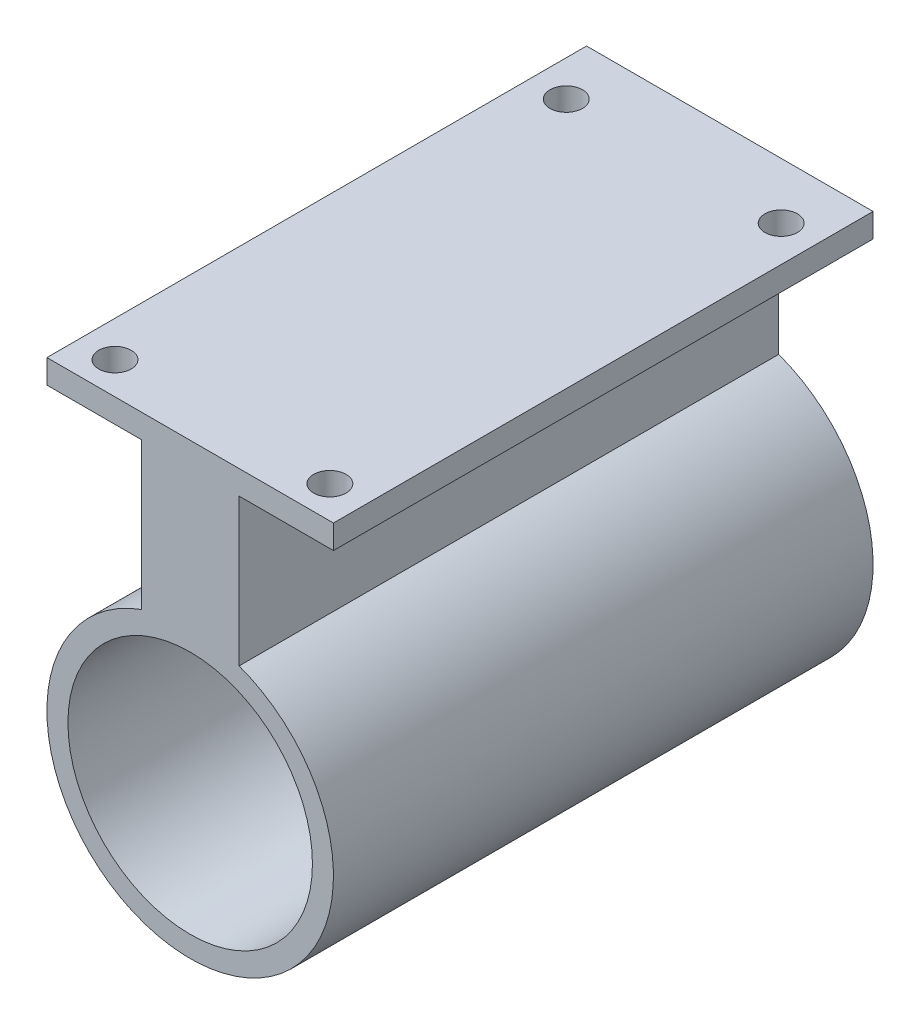
from build123d import *

# Parameters (mm, degrees)
CROQUIS1_R              = 12.5
SALIENTE_EXTRUIR1_DEPTH = 54
SALIENTE_EXTRUIR2_START = 2.5
CROQUIS2_R              = 15
SALIENTE_EXTRUIR2_DEPTH = 2.5
CROQUIS3_R              = 3.75
CORTAR_EXTRUIR2_DEPTH   = 2.5
CROQUIS5_R              = 1.5
CORTAR_EXTRUIR3_DEPTH   = 2.5
CROQUIS9_R              = 1.5
CORTAR_EXTRUIR5_DEPTH   = 2.5
SALIENTE_EXTRUIR3_START = 2.5
SALIENTE_EXTRUIR3_DEPTH = 2.5
CROQUIS11_R             = 12.8
CORTAR_EXTRUIR6_DEPTH   = 54
CROQUIS12_R             = 1.7
CORTAR_EXTRUIR7_DEPTH   = 2.5
CROQUIS16_R             = 1.7
CORTAR_EXTRUIR8_DEPTH   = 2.5
CROQUIS17_R             = 1.7
CORTAR_EXTRUIR9_DEPTH   = 2.5


with BuildPart() as part:
    # Croquis1 → Saliente-Extruir1 (new body)
    with BuildSketch(Plane.XY):
        with BuildLine():
            Line((-5.119897429, -1.25), (-15, -1.25))
            Line((-15, -1.25), (-15, 1.25))
            Line((-15, 1.25), (15, 1.25))
            Line((15, 1.25), (15, -1.25))
            Line((15, -1.25), (5.119897429, -1.25))
            Line((5.119897429, -1.25), (5.119897429, -13.25))
            Line((5.119897429, -13.25), (5.119897429, -16.650828027))
            ThreePointArc((5.119897429, -16.650828027), (0, -45.75), (-5.119897429, -16.650828027))
            Line((-5.119897429, -16.650828027), (-5.119897429, -13.25))
            Line((-5.119897429, -13.25), (-5.119897429, -1.25))
        make_face()
        with Locations((0, -30.75)):
            Circle(CROQUIS1_R, mode=Mode.SUBTRACT)
    extrude(amount=SALIENTE_EXTRUIR1_DEPTH)

    # Croquis2 → Saliente-Extruir2 (add)
    with BuildSketch(Plane(origin=(0, 0, 0), x_dir=(-1, 0, 0), z_dir=(0, 0, -1)).offset(SALIENTE_EXTRUIR2_START)):
        with Locations((0, -30.75)):
            Circle(CROQUIS2_R)
    extrude(amount=-SALIENTE_EXTRUIR2_DEPTH)

    # Croquis3 → Cortar-Extruir2 (cut)
    with BuildSketch(Plane(origin=(0, 0, -2.5), x_dir=(-1, 0, 0), z_dir=(0, 0, -1))):
        with Locations((0, -30.75)):
            Circle(CROQUIS3_R)
    extrude(amount=-CORTAR_EXTRUIR2_DEPTH, mode=Mode.SUBTRACT)

    # Croquis5 → Cortar-Extruir3 (cut)
    with BuildSketch(Plane(origin=(0, 0, -2.5), x_dir=(-1, 0, 0), z_dir=(0, 0, -1))):
        with Locations((0, -22.25)):
            Circle(CROQUIS5_R)
        with Locations((0, -39.25)):
            Circle(CROQUIS5_R)
    extrude(amount=-CORTAR_EXTRUIR3_DEPTH, mode=Mode.SUBTRACT)

    # Croquis9 → Cortar-Extruir5 (cut)
    with BuildSketch(Plane(origin=(0, 1.25, 0), x_dir=(1, 0, 0), z_dir=(0, 1, 0))):
        with Locations(Location((-11.25, -50.625, 0), (0, 0, 180))):
            Circle(CROQUIS9_R)
        with Locations((-11.25, -3.375)):
            Circle(CROQUIS9_R)
        with Locations((11.25, -50.625)):
            Circle(CROQUIS9_R)
        with Locations(Location((11.25, -3.375, 0), (0, 0, 180))):
            Circle(CROQUIS9_R)
    extrude(amount=-CORTAR_EXTRUIR5_DEPTH, mode=Mode.SUBTRACT)

    # Croquis10 → Saliente-Extruir3 (add)
    with BuildSketch(Plane(origin=(0, 0, 0), x_dir=(-1, 0, 0), z_dir=(0, 0, -1)).offset(SALIENTE_EXTRUIR3_START)):
        with BuildLine():
            Line((-15, 1.25), (15, 1.25))
            Line((15, 1.25), (15, -1.25))
            Line((15, -1.25), (5.119897429, -1.25))
            Line((5.119897429, -1.25), (5.119897429, -16.650828027))
            ThreePointArc((5.119897429, -16.650828027), (0, -15.75), (-5.119897429, -16.650828027))
            Line((-5.119897429, -16.650828027), (-5.119897429, -1.25))
            Line((-5.119897429, -1.25), (-15, -1.25))
            Line((-15, -1.25), (-15, 1.25))
        make_face()
    extrude(amount=-SALIENTE_EXTRUIR3_DEPTH)

    # Croquis11 → Cortar-Extruir6 (cut)
    with BuildSketch(Plane.XY.offset(54)):
        with Locations((0, -30.75)):
            Circle(CROQUIS11_R)
    extrude(amount=-CORTAR_EXTRUIR6_DEPTH, mode=Mode.SUBTRACT)

    # Croquis12 → Cortar-Extruir7 (cut)
    with BuildSketch(Plane(origin=(0, 0, -2.5), x_dir=(-1, 0, 0), z_dir=(0, 0, -1))):
        with Locations((0, -22.25)):
            Circle(CROQUIS12_R)
        with Locations((0, -39.25)):
            Circle(CROQUIS12_R)
    extrude(amount=-CORTAR_EXTRUIR7_DEPTH, mode=Mode.SUBTRACT)

    # Croquis16 → Cortar-Extruir8 (cut)
    with BuildSketch(Plane(origin=(0, 1.25, 0), x_dir=(1, 0, 0), z_dir=(0, 1, 0))):
        with Locations(Location((-11.25, -3.375, 0), (0, 0, 180))):
            Circle(CROQUIS16_R)
    extrude(amount=-CORTAR_EXTRUIR8_DEPTH, mode=Mode.SUBTRACT)

    # Croquis17 → Cortar-Extruir9 (cut)
    with BuildSketch(Plane(origin=(0, 1.25, 0), x_dir=(1, 0, 0), z_dir=(0, 1, 0))):
        with Locations(Location((-11.25, -3.375, 0), (0, 0, 180))):
            Circle(CROQUIS17_R)
        with Locations((11.25, -3.375)):
            Circle(CROQUIS17_R)
        with Locations(Location((-11.25, -50.625, 0), (0, 0, 180))):
            Circle(CROQUIS17_R)
        with Locations((11.25, -50.625)):
            Circle(CROQUIS17_R)
    extrude(amount=-CORTAR_EXTRUIR9_DEPTH, mode=Mode.SUBTRACT)


solid = part.part
